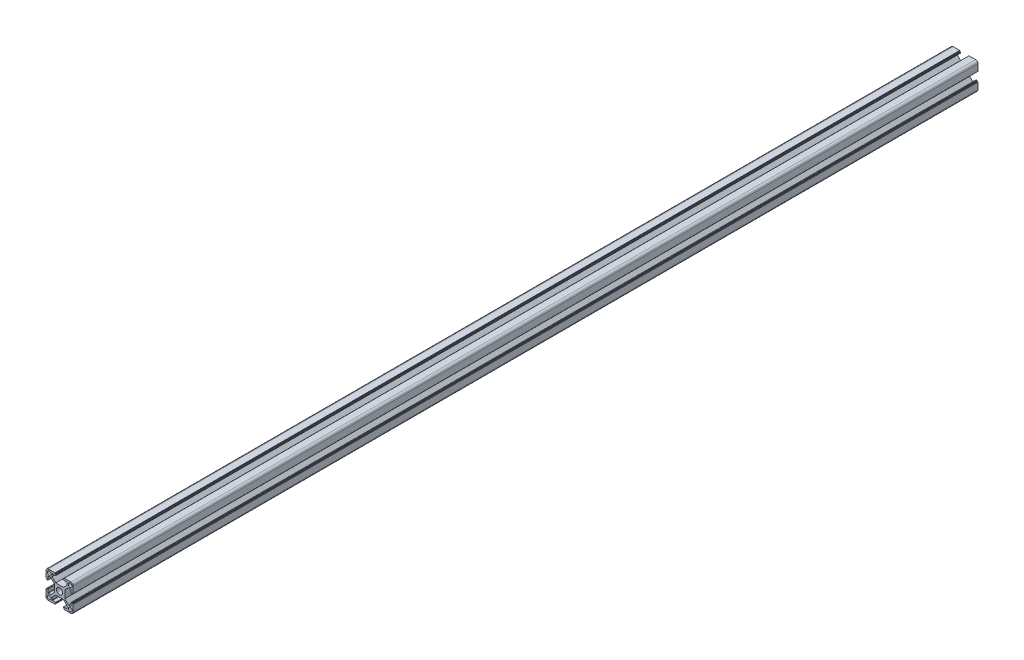
from build123d import *

# Parameters (mm, degrees)
SKETCH_1_R      = 3.4
SKETCH_1_R_2    = 2
EXTRUDE_1_DEPTH = 1000


with BuildPart() as part:
    # 草图1 → 凸台-拉伸1 (new body)
    with BuildSketch(Plane.XY):
        with BuildLine():
            Line((5.39426949, 3.798904284), (9.399904408, 7.804539202))
            Line((9.399904408, 7.804539202), (12.09426949, 7.804539202))
            ThreePointArc((12.09426949, 7.804539202), (12.306401524, 7.716671237), (12.39426949, 7.504539202))
            Line((12.39426949, 7.504539202), (12.39426949, 3.954539202))
            ThreePointArc((12.39426949, 3.954539202), (12.482137455, 3.742407168), (12.69426949, 3.654539202))
            Line((12.69426949, 3.654539202), (13.59426949, 3.654539202))
            Line((13.59426949, 3.654539202), (13.59426949, 4.454539202))
            ThreePointArc((13.59426949, 4.454539202), (13.652848133, 4.595960558), (13.79426949, 4.654539202))
            Line((13.79426949, 4.654539202), (14.59426949, 4.654539202))
            Line((14.59426949, 4.654539202), (14.59426949, 12.054539202))
            ThreePointArc((14.59426949, 12.054539202), (13.862036443, 13.822306155), (12.09426949, 14.554539202))
            Line((12.09426949, 14.554539202), (4.69426949, 14.554539202))
            Line((4.69426949, 14.554539202), (4.69426949, 13.754539202))
            ThreePointArc((4.69426949, 13.754539202), (4.635690846, 13.613117846), (4.49426949, 13.554539202))
            Line((4.49426949, 13.554539202), (3.69426949, 13.554539202))
            Line((3.69426949, 13.554539202), (3.69426949, 12.654539202))
            ThreePointArc((3.69426949, 12.654539202), (3.782137455, 12.442407168), (3.99426949, 12.354539202))
            Line((3.99426949, 12.354539202), (7.54426949, 12.354539202))
            ThreePointArc((7.54426949, 12.354539202), (7.756401524, 12.266671237), (7.84426949, 12.054539202))
            Line((7.84426949, 12.054539202), (7.84426949, 9.360174121))
            Line((7.84426949, 9.360174121), (3.838634571, 5.354539202))
            Line((3.838634571, 5.354539202), (-4.650095592, 5.354539202))
            Line((-4.650095592, 5.354539202), (-8.65573051, 9.360174121))
            Line((-8.65573051, 9.360174121), (-8.65573051, 12.054539202))
            ThreePointArc((-8.65573051, 12.054539202), (-8.567862545, 12.266671237), (-8.35573051, 12.354539202))
            Line((-8.35573051, 12.354539202), (-4.80573051, 12.354539202))
            ThreePointArc((-4.80573051, 12.354539202), (-4.593598476, 12.442407168), (-4.50573051, 12.654539202))
            Line((-4.50573051, 12.654539202), (-4.50573051, 13.554539202))
            Line((-4.50573051, 13.554539202), (-5.30573051, 13.554539202))
            ThreePointArc((-5.30573051, 13.554539202), (-5.447151867, 13.613117846), (-5.50573051, 13.754539202))
            Line((-5.50573051, 13.754539202), (-5.50573051, 14.554539202))
            Line((-5.50573051, 14.554539202), (-12.90573051, 14.554539202))
            ThreePointArc((-12.90573051, 14.554539202), (-14.673497463, 13.822306155), (-15.40573051, 12.054539202))
            Line((-15.40573051, 12.054539202), (-15.40573051, 4.654539202))
            Line((-15.40573051, 4.654539202), (-14.60573051, 4.654539202))
            ThreePointArc((-14.60573051, 4.654539202), (-14.464309154, 4.595960558), (-14.40573051, 4.454539202))
            Line((-14.40573051, 4.454539202), (-14.40573051, 3.654539202))
            Line((-14.40573051, 3.654539202), (-13.50573051, 3.654539202))
            ThreePointArc((-13.50573051, 3.654539202), (-13.293598476, 3.742407168), (-13.20573051, 3.954539202))
            Line((-13.20573051, 3.954539202), (-13.20573051, 7.504539202))
            ThreePointArc((-13.20573051, 7.504539202), (-13.117862545, 7.716671237), (-12.90573051, 7.804539202))
            Line((-12.90573051, 7.804539202), (-10.211365429, 7.804539202))
            Line((-10.211365429, 7.804539202), (-6.20573051, 3.798904284))
            Line((-6.20573051, 3.798904284), (-6.20573051, -4.689825879))
            Line((-6.20573051, -4.689825879), (-10.211365429, -8.695460798))
            Line((-10.211365429, -8.695460798), (-12.90573051, -8.695460798))
            ThreePointArc((-12.90573051, -8.695460798), (-13.117862545, -8.607592832), (-13.20573051, -8.395460798))
            Line((-13.20573051, -8.395460798), (-13.20573051, -4.845460798))
            ThreePointArc((-13.20573051, -4.845460798), (-13.293598476, -4.633328763), (-13.50573051, -4.545460798))
            Line((-13.50573051, -4.545460798), (-14.40573051, -4.545460798))
            Line((-14.40573051, -4.545460798), (-14.40573051, -5.345460798))
            ThreePointArc((-14.40573051, -5.345460798), (-14.464309154, -5.486882154), (-14.60573051, -5.545460798))
            Line((-14.60573051, -5.545460798), (-15.40573051, -5.545460798))
            Line((-15.40573051, -5.545460798), (-15.40573051, -12.945460798))
            ThreePointArc((-15.40573051, -12.945460798), (-14.673497463, -14.713227751), (-12.90573051, -15.445460798))
            Line((-12.90573051, -15.445460798), (-5.50573051, -15.445460798))
            Line((-5.50573051, -15.445460798), (-5.50573051, -14.645460798))
            ThreePointArc((-5.50573051, -14.645460798), (-5.447151867, -14.504039442), (-5.30573051, -14.445460798))
            Line((-5.30573051, -14.445460798), (-4.50573051, -14.445460798))
            Line((-4.50573051, -14.445460798), (-4.50573051, -13.545460798))
            ThreePointArc((-4.50573051, -13.545460798), (-4.593598476, -13.333328763), (-4.80573051, -13.245460798))
            Line((-4.80573051, -13.245460798), (-8.35573051, -13.245460798))
            ThreePointArc((-8.35573051, -13.245460798), (-8.567862545, -13.157592832), (-8.65573051, -12.945460798))
            Line((-8.65573051, -12.945460798), (-8.65573051, -10.251095716))
            Line((-8.65573051, -10.251095716), (-4.650095592, -6.245460798))
            Line((-4.650095592, -6.245460798), (3.838634571, -6.245460798))
            Line((3.838634571, -6.245460798), (7.84426949, -10.251095716))
            Line((7.84426949, -10.251095716), (7.84426949, -12.945460798))
            ThreePointArc((7.84426949, -12.945460798), (7.756401524, -13.157592832), (7.54426949, -13.245460798))
            Line((7.54426949, -13.245460798), (3.99426949, -13.245460798))
            ThreePointArc((3.99426949, -13.245460798), (3.782137455, -13.333328763), (3.69426949, -13.545460798))
            Line((3.69426949, -13.545460798), (3.69426949, -14.445460798))
            Line((3.69426949, -14.445460798), (4.49426949, -14.445460798))
            ThreePointArc((4.49426949, -14.445460798), (4.635690846, -14.504039442), (4.69426949, -14.645460798))
            Line((4.69426949, -14.645460798), (4.69426949, -15.445460798))
            Line((4.69426949, -15.445460798), (12.09426949, -15.445460798))
            ThreePointArc((12.09426949, -15.445460798), (13.862036443, -14.713227751), (14.59426949, -12.945460798))
            Line((14.59426949, -12.945460798), (14.59426949, -5.545460798))
            Line((14.59426949, -5.545460798), (13.79426949, -5.545460798))
            ThreePointArc((13.79426949, -5.545460798), (13.652848133, -5.486882154), (13.59426949, -5.345460798))
            Line((13.59426949, -5.345460798), (13.59426949, -4.545460798))
            Line((13.59426949, -4.545460798), (12.69426949, -4.545460798))
            ThreePointArc((12.69426949, -4.545460798), (12.482137455, -4.633328763), (12.39426949, -4.845460798))
            Line((12.39426949, -4.845460798), (12.39426949, -8.395460798))
            ThreePointArc((12.39426949, -8.395460798), (12.306401524, -8.607592832), (12.09426949, -8.695460798))
            Line((12.09426949, -8.695460798), (9.399904408, -8.695460798))
            Line((9.399904408, -8.695460798), (5.39426949, -4.689825879))
            Line((5.39426949, -4.689825879), (5.39426949, 3.798904284))
        make_face()
        with Locations((-0.40573051, -0.445460798)):
            Circle(SKETCH_1_R, mode=Mode.SUBTRACT)
        with Locations((-12.03073051, 11.179539202)):
            Circle(SKETCH_1_R_2, mode=Mode.SUBTRACT)
        with Locations((11.21926949, 11.179539202)):
            Circle(SKETCH_1_R_2, mode=Mode.SUBTRACT)
        with Locations((-12.03073051, -12.070460798)):
            Circle(SKETCH_1_R_2, mode=Mode.SUBTRACT)
        with Locations((11.21926949, -12.070460798)):
            Circle(SKETCH_1_R_2, mode=Mode.SUBTRACT)
    extrude(amount=EXTRUDE_1_DEPTH)


solid = part.part
